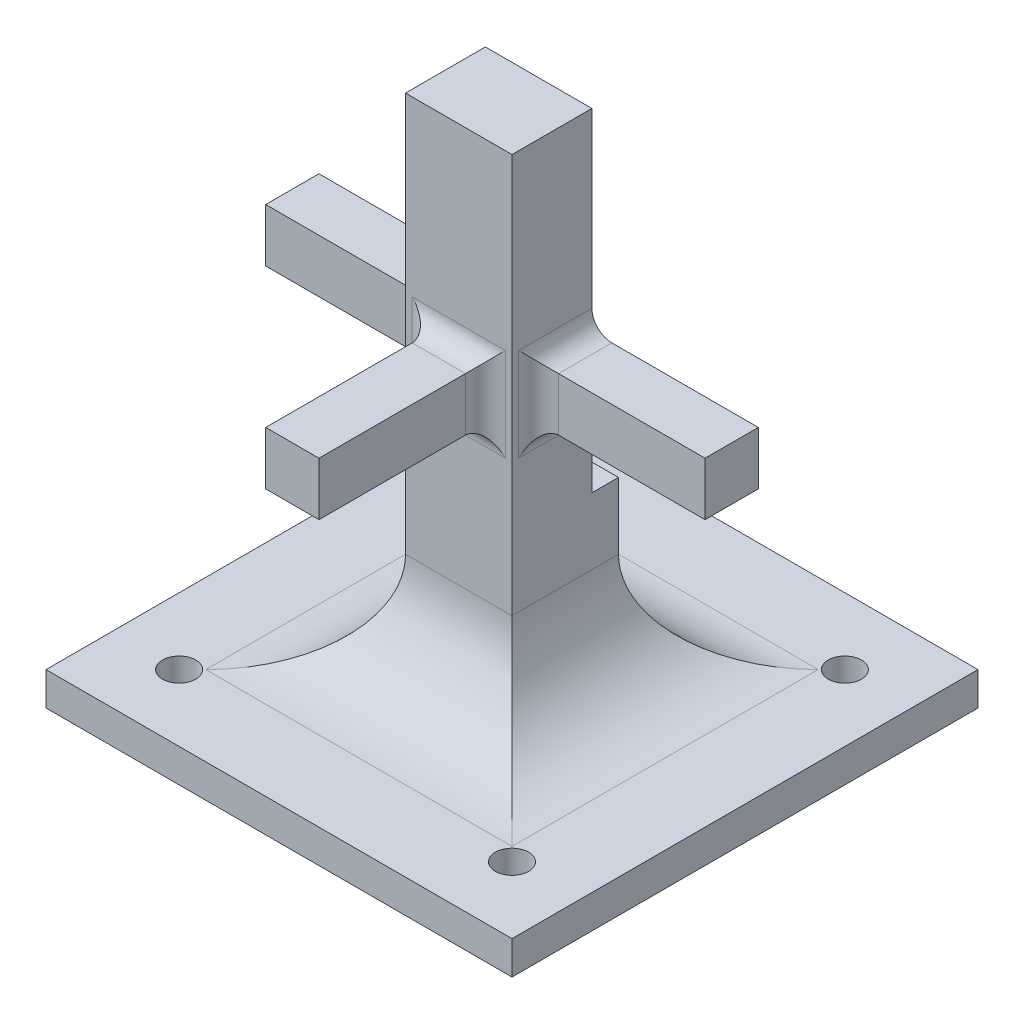
from build123d import *

# Parameters (mm, degrees)
SKETCH1_W           = 70
SKETCH1_H           = 70
BOSS_EXTRUDE1_DEPTH = 5
SKETCH2_R           = 2.5
CUT_EXTRUDE1_DEPTH  = 5
SKETCH3_R           = 2.5
CUT_EXTRUDE2_DEPTH  = 5
SKETCH4_R           = 2.5
CUT_EXTRUDE3_DEPTH  = 5
SKETCH5_R           = 2.5
CUT_EXTRUDE4_DEPTH  = 5
SKETCH7_W           = 16
SKETCH7_H           = 16
BOSS_EXTRUDE2_DEPTH = 75
SKETCH8_W           = 8
SKETCH8_H           = 8
BOSS_EXTRUDE3_DEPTH = 25
SKETCH9_W           = 8
SKETCH9_H           = 8
BOSS_EXTRUDE4_DEPTH = 25
SKETCH10_W          = 8
SKETCH10_H          = 8
BOSS_EXTRUDE5_DEPTH = 25
SKETCH11_W          = 16
SKETCH11_H          = 4
CUT_EXTRUDE5_DEPTH  = 50
FILLET1_R           = 15
FILLET2_R           = 3


with BuildPart() as part:
    # Sketch1 → Boss-Extrude1 (new body)
    with BuildSketch(Plane(origin=(0, 0, 0), x_dir=(1, 0, 0), z_dir=(0, 1, 0))):
        Rectangle(SKETCH1_W, SKETCH1_H)
    extrude(amount=BOSS_EXTRUDE1_DEPTH)

    # Sketch2 → Cut-Extrude1 (cut)
    with BuildSketch(Plane(origin=(0, 5, 0), x_dir=(1, 0, 0), z_dir=(0, 1, 0))):
        with Locations(Location((-25, 25, 0), (0, 0, 270))):
            Circle(SKETCH2_R)
    extrude(amount=-CUT_EXTRUDE1_DEPTH, mode=Mode.SUBTRACT)

    # Sketch3 → Cut-Extrude2 (cut)
    with BuildSketch(Plane(origin=(0, 5, 0), x_dir=(1, 0, 0), z_dir=(0, 1, 0))):
        with Locations(Location((25, 25, 0), (0, 0, 270))):
            Circle(SKETCH3_R)
    extrude(amount=-CUT_EXTRUDE2_DEPTH, mode=Mode.SUBTRACT)

    # Sketch4 → Cut-Extrude3 (cut)
    with BuildSketch(Plane(origin=(0, 5, 0), x_dir=(1, 0, 0), z_dir=(0, 1, 0))):
        with Locations(Location((-25, -25, 0), (0, 0, 270))):
            Circle(SKETCH4_R)
    extrude(amount=-CUT_EXTRUDE3_DEPTH, mode=Mode.SUBTRACT)

    # Sketch5 → Cut-Extrude4 (cut)
    with BuildSketch(Plane(origin=(0, 5, 0), x_dir=(1, 0, 0), z_dir=(0, 1, 0))):
        with Locations(Location((25, -25, 0), (0, 0, 270))):
            Circle(SKETCH5_R)
    extrude(amount=-CUT_EXTRUDE4_DEPTH, mode=Mode.SUBTRACT)

    # Sketch7 → Boss-Extrude2 (add)
    with BuildSketch(Plane(origin=(0, 5, 0), x_dir=(1, 0, 0), z_dir=(0, 1, 0))):
        Rectangle(SKETCH7_W, SKETCH7_H)
    extrude(amount=BOSS_EXTRUDE2_DEPTH)

    # Sketch8 → Boss-Extrude3 (add)
    with BuildSketch(Plane.XY.offset(8)):
        with Locations((0, 47)):
            Rectangle(SKETCH8_W, SKETCH8_H)
    extrude(amount=BOSS_EXTRUDE3_DEPTH)

    # Sketch9 → Boss-Extrude4 (add)
    with BuildSketch(Plane(origin=(8, 0, 0), x_dir=(0, 0, -1), z_dir=(1, 0, 0))):
        with Locations((0, 47)):
            Rectangle(SKETCH9_W, SKETCH9_H)
    extrude(amount=BOSS_EXTRUDE4_DEPTH)

    # Sketch10 → Boss-Extrude5 (add)
    with BuildSketch(Plane.ZY.offset(8)):
        with Locations((0, 47)):
            Rectangle(SKETCH10_W, SKETCH10_H)
    extrude(amount=BOSS_EXTRUDE5_DEPTH)

    # Sketch11 → Cut-Extrude5 (cut)
    with BuildSketch(Plane(origin=(0, 80, 0), x_dir=(1, 0, 0), z_dir=(0, 1, 0))):
        with Locations((0, 6)):
            Rectangle(SKETCH11_W, SKETCH11_H)
    extrude(amount=-CUT_EXTRUDE5_DEPTH, mode=Mode.SUBTRACT)

    # Fillet1
    fillet1_edges = [part.edges().sort_by_distance(p)[0] for p in [
        (8, 5, 0),
        (0, 5, -8),
        (-8, 5, 0),
        (0, 5, 8),
    ]]
    fillet(fillet1_edges, radius=FILLET1_R)

    # Fillet2
    fillet2_edges = [part.edges().sort_by_distance(p)[0] for p in [
        (4, 47, 8),
        (0, 51, 8),
        (-4, 47, 8),
        (0, 43, 8),
        (8, 51, 0),
        (8, 47, 4),
        (8, 43, 0),
        (-8, 47, 4),
        (-8, 51, 0),
        (-8, 43, 0),
    ]]
    fillet(fillet2_edges, radius=FILLET2_R)


solid = part.part
